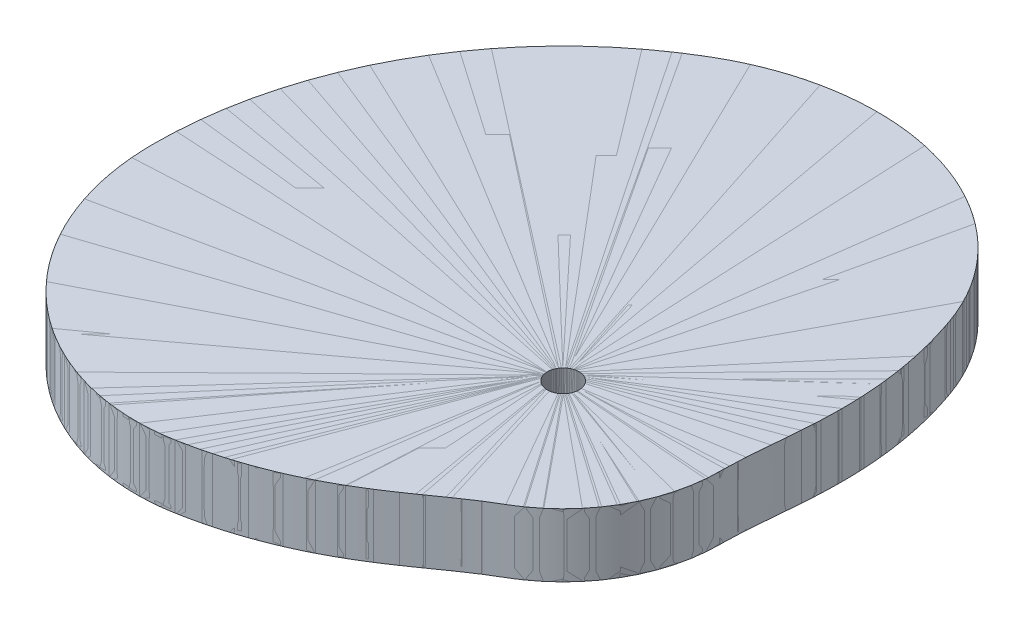
from build123d import *

# Parameters (mm, degrees)
SKETCH_1_W           = 125
SKETCH_1_H           = 20
EXTRUDE_1_DEPTH      = 10
EXTRUDE_1_DEPTH_BACK = 30
SKETCH_2_OUTSIDE_W   = 335.648
SKETCH_2_OUTSIDE_H   = 335.648
SKETCH_3_R           = 5
EXTRUDE_1_2_DEPTH    = 20


with BuildPart() as part:
    # 草图1 → 旋转1 (revolve)
    with BuildSketch(Plane.XY, mode=Mode.PRIVATE) as revolve_1_sk:
        with Locations((67.5, -10)):
            Rectangle(SKETCH_1_W, SKETCH_1_H)
    revolve(revolve_1_sk.sketch.rotate(Axis((0, -20200, 0), (0, 1, 0)), 90), axis=Axis((0, -20200, 0), (0, 1, 0)))

    # 草图2 outside → 凸台-拉伸1 (cut, two sides: drawn at the far end of the back side and taken through both)
    with BuildSketch(Plane(origin=(0, 0, 0), x_dir=(1, 0, 0), z_dir=(0, 1, 0)).offset(-EXTRUDE_1_DEPTH_BACK)):
        Rectangle(SKETCH_2_OUTSIDE_W, SKETCH_2_OUTSIDE_H)
        with BuildLine():
            ThreePointArc((49.5, 0), (49.522003902, 2.20101192), (49.586803675, 4.401179784))
            ThreePointArc((49.586803675, 4.401179784), (49.693801394, 6.656485153), (49.835800937, 8.909857504))
            ThreePointArc((49.835800937, 8.909857504), (50.014037902, 11.271336692), (50.212970941, 13.631162536))
            ThreePointArc((50.212970941, 13.631162536), (50.437148394, 16.148106857), (50.662964755, 18.664904667))
            ThreePointArc((50.662964755, 18.664904667), (50.89700113, 21.382651085), (51.110506521, 24.102087435))
            ThreePointArc((51.110506521, 24.102087435), (51.308533323, 27.06039267), (51.461958782, 30.021346081))
            ThreePointArc((51.461958782, 30.021346081), (51.569409755, 33.252730797), (51.607134457, 36.485681421))
            ThreePointArc((51.607134457, 36.485681421), (51.561933984, 40.013907512), (51.421470488, 43.539626224))
            ThreePointArc((51.421470488, 43.539626224), (51.155351471, 47.378376096), (50.768592452, 51.206853257))
            ThreePointArc((50.768592452, 51.206853257), (50.20855641, 55.358631163), (49.503236252, 59.488210272))
            ThreePointArc((49.503236252, 59.488210272), (48.573148745, 63.943471291), (47.474467997, 68.360179809))
            ThreePointArc((47.474467997, 68.360179809), (46.097521131, 73.094288239), (44.530735895, 77.769002062))
            ThreePointArc((44.530735895, 77.769002062), (42.604656504, 82.528401877), (40.298011434, 87.115455065))
            ThreePointArc((40.298011434, 87.115455065), (37.604302474, 91.545785765), (34.56817551, 95.748859775))
            ThreePointArc((34.56817551, 95.748859775), (31.174075456, 99.747159917), (27.481393941, 103.471461518))
            ThreePointArc((27.481393941, 103.471461518), (23.468076718, 106.944213921), (19.20439127, 110.104547889))
            ThreePointArc((19.20439127, 110.104547889), (14.664218285, 112.971648738), (9.924973663, 115.496128571))
            ThreePointArc((9.924973663, 115.496128571), (4.959489449, 117.692098926), (-0.151789418, 119.523259115))
            ThreePointArc((-0.151789418, 119.523259115), (-5.433965213, 120.998174308), (-10.807627759, 122.093850722))
            ThreePointArc((-10.807627759, 122.093850722), (-16.292977452, 122.813988134), (-21.815307765, 123.147944812))
            ThreePointArc((-21.815307765, 123.147944812), (-27.387630158, 123.096151544), (-32.942976067, 122.65844021))
            ThreePointArc((-32.942976067, 122.65844021), (-38.485608119, 121.834223171), (-43.958541912, 120.631268688))
            ThreePointArc((-43.958541912, 120.631268688), (-49.356557792, 119.050611025), (-54.634032237, 117.105021764))
            ThreePointArc((-54.634032237, 117.105021764), (-59.776394568, 114.79992941), (-64.75, 112.15028979))
            ThreePointArc((-64.75, 112.15028979), (-112.15028979, 64.75), (-129.5, 0))
            ThreePointArc((-129.5, 0), (-129.307852505, -5.632088462), (-128.732939877, -11.238051053))
            ThreePointArc((-128.732939877, -11.238051053), (-127.77913238, -16.781272621), (-126.449014131, -22.246420335))
            ThreePointArc((-126.449014131, -22.246420335), (-124.754336377, -27.587597274), (-122.696813244, -32.799765954))
            ThreePointArc((-122.696813244, -32.799765954), (-120.298209424, -37.829692306), (-117.556902514, -42.68136169))
            ThreePointArc((-117.556902514, -42.68136169), (-114.50652239, -47.29686169), (-111.140190251, -51.687245167))
            ThreePointArc((-111.140190251, -51.687245167), (-107.504475369, -55.793135236), (-103.586073445, -59.630176065))
            ThreePointArc((-103.586073445, -59.630176065), (-99.444602771, -63.141093315), (-95.06009455, -66.34334361))
            ThreePointArc((-95.06009455, -66.34334361), (-90.504208572, -69.185409931), (-85.751139909, -71.683764649))
            ThreePointArc((-85.751139909, -71.683764649), (-80.882367685, -73.796057576), (-75.868217271, -75.535316044))
            ThreePointArc((-75.868217271, -75.535316044), (-70.796536715, -76.871121243), (-65.636857194, -77.811348042))
            ThreePointArc((-65.636857194, -77.811348042), (-60.478824845, -78.339174116), (-55.295191431, -78.456829156))
            ThreePointArc((-55.295191431, -78.456829156), (-50.169364307, -78.160915791), (-45.084563465, -77.449249565))
            ThreePointArc((-45.084563465, -77.449249565), (-40.252749921, -76.46876847), (-35.464418323, -75.29418522))
            ThreePointArc((-35.464418323, -75.29418522), (-31.090096172, -74.0373164), (-26.766683195, -72.615165299))
            ThreePointArc((-26.766683195, -72.615165299), (-22.837702701, -71.161200919), (-18.962139542, -69.570317407))
            ThreePointArc((-18.962139542, -69.570317407), (-15.453201553, -67.991021962), (-11.995687137, -66.302112854))
            ThreePointArc((-11.995687137, -66.302112854), (-8.872093418, -64.660898454), (-5.793959756, -62.935930167))
            ThreePointArc((-5.793959756, -62.935930167), (-3.013004738, -61.286784304), (-0.268268971, -59.578036674))
            ThreePointArc((-0.268268971, -59.578036674), (2.219279173, -57.964689623), (4.682233258, -56.314040765))
            ThreePointArc((4.682233258, -56.314040765), (6.930581526, -54.769421498), (9.167200776, -53.207866842))
            ThreePointArc((9.167200776, -53.207866842), (11.233903436, -51.753905232), (13.301552432, -50.301289702))
            ThreePointArc((13.301552432, -50.301289702), (15.245755041, -48.949095714), (17.201737526, -47.613998381))
            ThreePointArc((17.201737526, -47.613998381), (19.082215454, -46.364336995), (20.981868338, -45.144021567))
            ThreePointArc((20.981868338, -45.144021567), (22.854869714, -43.987819385), (24.75, -42.868257487))
            ThreePointArc((24.75, -42.868257487), (42.868257487, -24.75), (49.5, 0))
        make_face(mode=Mode.SUBTRACT)
    extrude(amount=EXTRUDE_1_DEPTH + EXTRUDE_1_DEPTH_BACK, mode=Mode.SUBTRACT)


with BuildPart() as body_2:
    # 草图3 → Extrude 1 2 (new body)
    with BuildSketch(Plane(origin=(0, 0, 0), x_dir=(1, 0, 0), z_dir=(0, 1, 0))):
        with BuildLine():
            add(Edge.make_bspline(
                [(20.02967354, -45.750492484), (19.396443191, -46.157272465), (18.766389748, -46.568955942), (18.13955118, -46.985518105), (18.035079397, -47.054944261), (17.826315483, -47.194066912), (17.513570884, -47.40335867), (17.305649352, -47.543736891), (17.201737526, -47.613998381), (17.092747481, -47.687693583), (16.874875072, -47.835243239), (16.548389417, -48.057045545), (16.330949129, -48.205231269), (16.222283174, -48.279403522), (15.570284837, -48.724438817), (14.920243579, -49.172327875), (14.272171891, -49.623062092), (14.164160374, -49.698184161), (13.948247107, -49.848586124), (13.62459849, -50.074508861), (13.409231879, -50.225692444), (13.301552419, -50.301289712), (13.186656761, -50.38195317), (12.9568742, -50.543292558), (12.612226621, -50.785339047), (12.382479085, -50.946728306), (12.267609697, -51.027429169), (11.57839334, -51.511634363), (10.88933467, -51.996063929), (10.200433759, -52.480717816), (9.961671734, -52.648691093), (9.484185591, -52.984691533), (8.768046515, -53.488824211), (8.289727415, -53.823638559), (8.050365266, -53.99075555), (7.304821973, -54.511276242), (6.557318505, -55.028978047), (5.80786552, -55.543853584), (5.68295706, -55.629665918), (5.433032131, -55.801133368), (5.057820634, -56.057862938), (4.807464855, -56.228700698), (4.682233257, -56.314040766), (4.546114879, -56.406799717), (4.27375122, -56.592131397), (3.864130501, -56.868550928), (3.590697316, -57.052301325), (3.453865562, -57.14400469), (2.63286533, -57.694231389), (1.807742589, -58.238256445), (0.978544182, -58.776048973), (0.840346082, -58.86568), (0.563724765, -59.044594958), (0.148117104, -59.3119263), (-0.129399447, -59.489449478), (-0.268268971, -59.578036674), (-0.41970353, -59.674639318), (-0.72283723, -59.86742985), (-1.178907914, -60.154468013), (-1.483541683, -60.344879857), (-1.636029221, -60.439811661), (-2.550976623, -61.009416293), (-3.472014376, -61.569119467), (-4.39903533, -62.118856072), (-4.553535078, -62.210476619), (-4.862863975, -62.393162244), (-5.327846296, -62.665524676), (-5.638480806, -62.845981333), (-5.793959756, -62.935930167), (-5.963642857, -63.034096491), (-6.303394236, -63.229763347), (-6.814600367, -63.520535283), (-7.156191635, -63.712972575), (-7.327202959, -63.808806331), (-8.353309886, -64.383830713), (-9.387088209, -64.944946428), (-10.428349409, -65.492051151), (-10.601886349, -65.583231807), (-10.949370664, -65.764811972), (-11.471829806, -66.034839379), (-11.820934744, -66.213283902), (-11.995687137, -66.302112854), (-12.18626196, -66.398984556), (-12.567887137, -66.591792449), (-13.14202307, -66.877666185), (-13.525711142, -67.066335946), (-13.71780122, -67.160167133), (-14.870401126, -67.72318329), (-16.031716064, -68.267996424), (-17.201458575, -68.794471678), (-17.396405607, -68.882213029), (-17.786759816, -69.05667336), (-18.373673649, -69.315297494), (-18.765836243, -69.48565393), (-18.962139542, -69.570317407), (-19.175861758, -69.662493472), (-19.603832486, -69.845625312), (-20.247509004, -70.116339159), (-20.67762689, -70.294369789), (-20.892944236, -70.382755606), (-22.184931139, -70.913104507), (-23.486022019, -71.420709308), (-24.795816527, -71.905413816), (-25.014101617, -71.986192722), (-25.451144125, -72.146474185), (-26.108103512, -72.383136958), (-26.547007167, -72.538249405), (-26.766683196, -72.6151653), (-27.005339101, -72.698726681), (-27.483180144, -72.86433793), (-28.201533111, -73.108221176), (-28.681433591, -73.267766393), (-28.921634041, -73.346778353), (-30.362945144, -73.820885773), (-31.813003875, -74.267523452), (-33.271286745, -74.686530148), (-33.51431561, -74.756359344), (-34.000815598, -74.894478528), (-34.731874933, -75.09711935), (-35.220102317, -75.229002134), (-35.464418323, -75.29418522), (-35.729079727, -75.364796424), (-36.258877362, -75.504239109), (-37.055002901, -75.708064721), (-37.586627985, -75.840369547), (-37.852659941, -75.905627492), (-39.448987027, -76.297208363), (-41.052888459, -76.656507598), (-42.663711494, -76.983378972), (-42.932159237, -77.037852915), (-43.469421033, -77.14499562), (-44.276417304, -77.300294596), (-44.815071471, -77.400201977), (-45.084563465, -77.449249565), (-45.3652539, -77.500335272), (-45.926992572, -77.600540744), (-46.772616664, -77.734353434), (-47.337175116, -77.817276339), (-47.619722541, -77.856821538), (-49.315592201, -78.094174622), (-51.019714252, -78.262336522), (-52.729266892, -78.361028784), (-53.014094026, -78.377471819), (-53.58397133, -78.406494459), (-54.439473508, -78.438591884), (-55.009931036, -78.451994186), (-55.295191431, -78.456829156), (-55.583260451, -78.461711731), (-56.159463004, -78.467670662), (-57.023979274, -78.465186982), (-57.600138077, -78.455917417), (-57.888174288, -78.449379742), (-59.616957525, -78.410140844), (-61.342827543, -78.302419658), (-63.063072621, -78.126385437), (-63.34443353, -78.097593523), (-63.906781897, -78.036360241), (-64.749221659, -77.933699361), (-65.30977265, -77.857759724), (-65.589799881, -77.818039633), (-65.883563239, -77.776371158), (-66.470543519, -77.689181815), (-67.349393021, -77.546834209), (-67.933884612, -77.444279782), (-68.225781634, -77.39108861), (-69.94653127, -77.077523607), (-71.653881798, -76.697712477), (-73.345283839, -76.252222345), (-73.617145111, -76.180618131), (-74.15997792, -76.034031631), (-74.971614448, -75.804147739), (-75.51059716, -75.64398578), (-75.779598843, -75.562292396), (-76.071619007, -75.473608506), (-76.654505212, -75.29244041), (-77.525389581, -75.009278067), (-78.103362969, -74.813000276), (-78.39169887, -74.712985196), (-80.063875617, -74.13295721), (-81.712984665, -73.490269971), (-83.336679016, -72.785838149), (-83.593650873, -72.67435217), (-84.106262931, -72.448310786), (-84.871257719, -72.100155902), (-85.378268365, -71.861817267), (-85.63107713, -71.741188138), (-85.913702996, -71.606331611), (-86.477213616, -71.33296962), (-87.317272228, -70.911967977), (-87.873536365, -70.624146492), (-88.150727877, -70.478446362), (-89.735803666, -69.645283229), (-91.289058431, -68.754202034), (-92.808376806, -67.806416333), (-93.045212546, -67.658672759), (-93.517183702, -67.360459958), (-94.220120919, -66.905060112), (-94.685037697, -66.595965594), (-94.916626461, -66.44012601), (-95.182867737, -66.260968228), (-95.713051613, -65.899236668), (-96.501445694, -65.346377129), (-97.022172726, -64.971159828), (-97.281322025, -64.781888677), (-98.74346293, -63.714005825), (-100.166011218, -62.59392271), (-101.547104234, -61.423105946), (-101.758835264, -61.243611708), (-102.180305307, -60.88227345), (-102.806619608, -60.333291799), (-103.21989597, -59.962610695), (-103.425527214, -59.776159623), (-103.669131163, -59.555277736), (-104.153512732, -59.11039689), (-104.87161844, -58.433707985), (-105.344456405, -57.976577008), (-105.579403449, -57.746508369), (-106.886088596, -56.466955031), (-108.146436795, -55.141736092), (-109.358853165, -53.772528524), (-109.540904118, -53.566934514), (-109.9028091, -53.153801145), (-110.439159046, -52.528318934), (-110.792083771, -52.107488628), (-110.967442779, -51.896157928), (-111.182972851, -51.636415804), (-111.610699464, -51.114165441), (-112.242298994, -50.322472963), (-112.656479689, -49.789415886), (-112.861851265, -49.521569477), (-113.98442211, -48.057508213), (-115.054970903, -46.554988341), (-116.072181222, -45.015857466), (-116.220463011, -44.791493758), (-116.514732208, -44.341249986), (-116.949328664, -43.661369775), (-117.234265817, -43.205163293), (-117.375586175, -42.976350882), (-117.558505556, -42.680185311), (-117.920496942, -42.085477932), (-118.451949803, -41.186267173), (-118.798367915, -40.582355655), (-118.969608449, -40.279287635), (-119.883743587, -38.66141645), (-120.741253882, -37.012833328), (-121.54110888, -35.335519343), (-121.652068468, -35.102834582), (-121.871749153, -34.636397598), (-122.194618269, -33.933558122), (-122.405232605, -33.46295798), (-122.509421559, -33.227163811), (-122.656214719, -32.894950367), (-122.945361649, -32.228561873), (-123.365769234, -31.223070119), (-123.637003096, -30.549191967), (-123.770362804, -30.211361843), (-124.456473965, -28.473288017), (-125.082456746, -26.712664631), (-125.647571812, -24.931571115), (-125.718102316, -24.709277584), (-125.857255919, -24.264085331), (-126.060310956, -23.594488287), (-126.191767571, -23.146962924), (-126.256543805, -22.922924969), (-126.365052257, -22.547632829), (-126.576726028, -21.795503687), (-126.878209428, -20.66264513), (-127.068381121, -19.90479372), (-127.160764853, -19.525210369), (-127.604310219, -17.702785221), (-127.985335138, -15.866270608), (-128.303394751, -14.01781071), (-128.347923311, -13.75902508), (-128.434503926, -13.241027694), (-128.556971068, -12.462747808), (-128.633600133, -11.943185096), (-128.670677671, -11.683227309), (-128.721941532, -11.323806476), (-128.819739937, -10.604290273), (-128.952248312, -9.522968386), (-129.031078033, -8.801127705), (-129.068116767, -8.439963683), (-129.259828378, -6.570587247), (-129.387795304, -4.695768305), (-129.451869224, -2.81767988), (-129.462545632, -2.504740734), (-129.480347116, -1.878741283), (-129.49772869, -0.939363643), (-129.5, -0.313121214), (-129.5, 0), (-129.5, 0.314010981), (-129.497715763, 0.942032944), (-129.487436017, 1.884072118), (-129.476015104, 2.511994379), (-129.469162801, 2.825930587), (-128.481878812, 48.058050592), (-105.860432075, 87.239545681), (-67.181909078, 110.710618699), (-66.913458499, 110.873521071), (-66.375372325, 111.197373002), (-65.564682343, 111.67729511), (-65.021941488, 111.993284299), (-64.750000001, 112.15028979), (-64.478829074, 112.306850397), (-63.935351567, 112.618004599), (-63.11313588, 113.072640535), (-62.56210371, 113.370223723), (-62.285752256, 113.517447256), (-60.627243009, 114.401001826), (-58.939618715, 115.227588688), (-57.224835427, 115.996249781), (-56.893538843, 116.144755307), (-56.228991614, 116.437407106), (-55.226285203, 116.863312431), (-54.55426669, 117.138374629), (-54.217367188, 117.27368924), (-53.973698371, 117.371558043), (-53.485429331, 117.564976683), (-52.750185608, 117.848056969), (-52.258296405, 118.032074651), (-52.011917195, 118.122904602), (-50.252074159, 118.771686845), (-48.47109339, 119.359966893), (-46.671054232, 119.887057912), (-46.296133542, 119.996842928), (-45.544729122, 120.211075116), (-44.412903133, 120.516412111), (-43.655703304, 120.70916182), (-43.276436551, 120.802836814), (-43.050025874, 120.858757927), (-42.596729233, 120.96867584), (-41.915313664, 121.127623542), (-41.460189061, 121.229709113), (-41.232411964, 121.27977467), (-39.4073822, 121.680917425), (-37.569646231, 122.019112128), (-35.721374563, 122.293959346), (-35.36212524, 122.347381512), (-34.642912709, 122.449425174), (-33.561927515, 122.588087402), (-32.840244685, 122.670873062), (-32.479142823, 122.709853178), (-32.222844605, 122.737519982), (-31.70998576, 122.790422688), (-30.939874361, 122.862229569), (-30.426087741, 122.905199007), (-30.169097033, 122.925447566), (-28.316573013, 123.071409811), (-26.460103001, 123.153075672), (-24.601917886, 123.170347013), (-24.253833015, 123.17358237), (-23.557621242, 123.175531244), (-22.513155451, 123.164884945), (-21.81712806, 123.148744898), (-21.469181461, 123.138414853), (-21.200363922, 123.130434038), (-20.662808942, 123.111774466), (-19.85671718, 123.075343001), (-19.319660038, 123.045620286), (-19.051214472, 123.029386344), (-17.209682875, 122.918021804), (-15.3731881, 122.742159289), (-13.543988431, 122.502015052), (-13.209340848, 122.458081255), (-12.54060953, 122.365918789), (-11.539183966, 122.21478379), (-10.873038579, 122.10548686), (-10.540330265, 122.048703403), (-10.269633006, 122.002503398), (-9.728720908, 121.907276774), (-8.91886245, 121.755525201), (-8.380125967, 121.648672977), (-8.111050855, 121.593809231), (-6.319074133, 121.22842964), (-4.541226767, 120.799545551), (-2.779758497, 120.307699687), (-2.463039689, 120.219263899), (-1.830733668, 120.038339697), (-0.885651032, 119.754786364), (-0.258182133, 119.557740044), (0.054909167, 119.457213779), (0.319196154, 119.372357434), (0.846853588, 119.199790157), (1.635442794, 118.931876888), (2.159105926, 118.747542252), (2.420418012, 118.653924921), (4.124921581, 118.043271666), (5.806216156, 117.371350268), (7.462100287, 116.639040526), (7.755588562, 116.509246225), (8.340899792, 116.245892037), (9.213887237, 115.839552505), (9.792247896, 115.561265579), (10.080523725, 115.420272762), (10.331279145, 115.297630801), (10.831421239, 115.04954832), (11.577277683, 114.668486755), (12.071523122, 114.408854145), (12.317890681, 114.277620165), (13.898356363, 113.435744706), (15.446682697, 112.536127219), (16.96076103, 111.579992885), (17.2255368, 111.412788058), (17.752929586, 111.074959927), (18.53755701, 110.55794865), (19.056050749, 110.206615133), (19.31415286, 110.029282217), (19.545025133, 109.870657969), (20.004937768, 109.550743187), (20.688946136, 109.062315708), (21.141009746, 108.731401336), (21.366045364, 108.564600169), (22.787948394, 107.510655525), (24.169086393, 106.403828815), (25.507493737, 105.245695265), (25.738277288, 105.04599659), (26.197245535, 104.643595849), (26.877913502, 104.030969033), (27.326252779, 103.61675882), (27.549065362, 103.408203884), (27.75431475, 103.216088285), (28.16251043, 102.829396544), (28.767413985, 102.241440638), (29.165778022, 101.844626886), (29.363719727, 101.644990225), (30.595226518, 100.402938156), (31.77782787, 99.11423479), (32.909757946, 97.780804393), (33.101771363, 97.554609743), (33.482831897, 97.09970239), (34.045533291, 96.409770199), (34.414531616, 95.945025038), (34.597499253, 95.711452744), (34.771911477, 95.488802094), (35.117952627, 95.041320513), (35.628079439, 94.363076718), (35.9622832, 93.906685387), (36.127898184, 93.677415649), (37.14047083, 92.275656821), (38.096695123, 90.834870135), (38.995068624, 89.357319383), (39.144748522, 89.111141545), (39.440855602, 88.616808167), (39.875264667, 87.869356955), (40.158205358, 87.367371441), (40.298011434, 87.115455064), (40.436454424, 86.865994831), (40.710076454, 86.365262968), (41.110030358, 85.608327637), (41.369834667, 85.100288095), (41.498008148, 84.845399043), (42.267314461, 83.315536897), (42.973743009, 81.75564296), (43.616124039, 80.168300211), (43.723150605, 79.903834364), (43.933616489, 79.373450949), (44.240543346, 78.574212659), (44.434632197, 78.037629963), (44.530735895, 77.769002062), (44.623005434, 77.511091355), (44.805810188, 76.994649471), (45.074815465, 76.218120712), (45.250658059, 75.699266996), (45.337706112, 75.43954746), (45.860038715, 73.881098103), (46.350827167, 72.3124291), (46.809871728, 70.734178855), (46.886372668, 70.471159451), (47.037605869, 69.94460621), (47.259150481, 69.153228463), (47.40328839, 68.62468891), (47.474467997, 68.360179809), (47.540175791, 68.116004397), (47.670075641, 67.627245688), (47.860113209, 66.892809321), (47.983748482, 66.402428381), (48.044789056, 66.157044612), (48.411060048, 64.684631252), (48.749289838, 63.205524715), (49.059356319, 61.720258975), (49.111030179, 61.472733304), (49.212810209, 60.977354688), (49.360777606, 60.233301146), (49.456274578, 59.73667304), (49.503236252, 59.488210272), (49.546463147, 59.259507304), (49.631583656, 58.801849365), (49.755107375, 58.11457446), (49.834820811, 57.655943814), (49.874006771, 57.426513928), (50.109137607, 56.049846356), (50.320084395, 54.669266201), (50.506782225, 53.285198271), (50.537896535, 53.054535071), (50.59877643, 52.59302674), (50.686169621, 51.9002296), (50.741558159, 51.438030157), (50.768592452, 51.206853257), (50.793423381, 50.994517875), (50.841971677, 50.569716888), (50.911453523, 49.932122531), (50.955543549, 49.506835704), (50.977030826, 49.294135948), (51.105961137, 48.01787159), (51.214796591, 46.739736785), (51.30351025, 45.460047907), (51.318295097, 45.246777427), (51.346746327, 44.820158929), (51.386240376, 44.180005757), (51.410076432, 43.753104712), (51.421470488, 43.539626224), (51.431918555, 43.343871736), (51.451933534, 42.952315729), (51.479312511, 42.364839137), (51.495801633, 41.97311881), (51.503605338, 41.777241083), (51.55042935, 40.60193007), (51.581378047, 39.426093923), (51.596445788, 38.249947067), (51.598956983, 38.053930038), (51.603097034, 37.661884676), (51.606884216, 37.073781212), (51.607307437, 36.681714458), (51.607134457, 36.485681421), (51.606975957, 36.306058283), (51.606013163, 35.946812578), (51.602631538, 35.407944859), (51.599085595, 35.048715364), (51.596989748, 34.869104384), (51.584414359, 33.791412385), (51.560216068, 32.713918707), (51.524397688, 31.636748698), (51.518428102, 31.457224714), (51.505843493, 31.098198209), (51.485296494, 30.559710329), (51.469901846, 30.200793579), (51.461958782, 30.021346081), (51.454674781, 29.856787948), (51.439693475, 29.527689975), (51.415981572, 29.034097511), (51.399347333, 28.705078945), (51.390823635, 28.540580366), (51.339680848, 27.553577217), (51.2811027, 26.566987434), (51.215092517, 25.580867027), (51.204090949, 25.41651557), (51.181675031, 25.087840287), (51.147099053, 24.594888572), (51.12277894, 24.266348884), (51.110506521, 24.102087435), (51.099215654, 23.950963657), (51.076443703, 23.648730312), (51.041715123, 23.195422839), (51.018182419, 22.893247776), (51.006320987, 22.74216771), (50.935152186, 21.835684618), (50.860561005, 20.929476723), (50.782548509, 20.023556944), (50.757502024, 19.732704747), (50.706703843, 19.151061082), (50.628181675, 18.278800111), (50.57593983, 17.697284761), (50.549851717, 17.406524143), (50.474579594, 16.56759151), (50.399580619, 15.728634414), (50.324854798, 14.889652943), (50.312400496, 14.749822703), (50.287507065, 14.470160871), (50.250212446, 14.050664068), (50.225379718, 13.770996839), (50.212970943, 13.631162552), (50.201341519, 13.500110769), (50.178096001, 13.238006022), (50.144265479, 12.844756729), (50.121970193, 12.582569373), (50.110918331, 12.451467621), (50.044606893, 11.664853968), (49.981744219, 10.877957195), (49.922331516, 10.090792424), (49.912429439, 9.959598821), (49.892816981, 9.697197146), (49.863973377, 9.303551122), (49.845127831, 9.041093253), (49.835800937, 8.909857504), (49.826908615, 8.784736478), (49.809298275, 8.534482039), (49.784418595, 8.158991391), (49.768316802, 7.908635214), (49.760427879, 7.783446918), (49.713093747, 7.032307712), (49.67159212, 6.280823686), (49.635925497, 5.529040127), (49.629981134, 5.403744441), (49.618416634, 5.153137685), (49.602042556, 4.777181091), (49.59177519, 4.526517841), (49.586803675, 4.401179784), (49.58195703, 4.278989872), (49.572571986, 4.03459782), (49.560251719, 3.667940682), (49.552655486, 3.423486365), (49.549055457, 3.301253372), (49.527454851, 2.567840971), (49.512986432, 1.834253211), (49.505651567, 1.100559449), (49.503203199, 0.855653421), (49.499896253, 0.365825472), (49.500442653, -0.368978597), (49.493156006, -0.85877442), (49.487695408, -1.103631805), (49.102520818, -18.375155434), (40.464611813, -33.336452702), (25.699620884, -42.305785496), (25.490298467, -42.432943205), (25.069766165, -42.684151538), (24.433133974, -43.051080376), (24.010584, -43.29885825), (23.799713343, -43.423431613), (23.167983339, -43.796630673), (22.539911912, -44.175954571), (21.915558444, -44.561367445), (21.811501582, -44.625601659), (21.60359605, -44.754407347), (21.292221787, -44.948405581), (21.085264583, -45.078729293), (20.981868338, -45.144021567), (20.875808154, -45.210996054), (20.663861095, -45.345219479), (20.346460172, -45.547378143), (20.135210606, -45.682696672), (20.02967354, -45.750492484)],
                knots=[0, 0, 0, 0, 0.003776693, 0.003776693, 0.003776693, 0.004406147, 0.0050356, 0.005665054, 0.005665054, 0.005665054, 0.006325269, 0.006985485, 0.0076457, 0.0076457, 0.0076457, 0.011606982, 0.011606982, 0.011606982, 0.012267198, 0.012927413, 0.013587628, 0.013587628, 0.013587628, 0.014292088, 0.014996548, 0.015701008, 0.015701008, 0.015701008, 0.019927768, 0.019927768, 0.019927768, 0.021392695, 0.022857623, 0.02432255, 0.02432255, 0.02432255, 0.02888535, 0.02888535, 0.02888535, 0.029645818, 0.030406286, 0.031166754, 0.031166754, 0.031166754, 0.031993332, 0.03281991, 0.033646488, 0.033646488, 0.033646488, 0.03860592, 0.03860592, 0.03860592, 0.039432498, 0.040259076, 0.041085654, 0.041085654, 0.041085654, 0.041987021, 0.042888389, 0.043789756, 0.043789756, 0.043789756, 0.049197882, 0.049197882, 0.049197882, 0.050099249, 0.051000617, 0.051901984, 0.051901984, 0.051901984, 0.052885698, 0.053869412, 0.054853126, 0.054853126, 0.054853126, 0.060755275, 0.060755275, 0.060755275, 0.061738989, 0.062722703, 0.063706417, 0.063706417, 0.063706417, 0.064779199, 0.06585198, 0.066924761, 0.066924761, 0.066924761, 0.073361251, 0.073361251, 0.073361251, 0.074434032, 0.075506813, 0.076579595, 0.076579595, 0.076579595, 0.077747569, 0.078915543, 0.080083518, 0.080083518, 0.080083518, 0.087091094, 0.087091094, 0.087091094, 0.088259069, 0.089427043, 0.090595017, 0.090595017, 0.090595017, 0.091863904, 0.09313279, 0.094401677, 0.094401677, 0.094401677, 0.102014653, 0.102014653, 0.102014653, 0.10328354, 0.104552426, 0.105821313, 0.105821313, 0.105821313, 0.107195866, 0.108570419, 0.109944972, 0.109944972, 0.109944972, 0.118191871, 0.118191871, 0.118191871, 0.119566424, 0.120940977, 0.12231553, 0.12231553, 0.12231553, 0.123747201, 0.125178872, 0.126610543, 0.126610543, 0.126610543, 0.135198792, 0.135198792, 0.135198792, 0.136630463, 0.138062134, 0.139493805, 0.139493805, 0.139493805, 0.140939572, 0.142385339, 0.143831106, 0.143831106, 0.143831106, 0.152504005, 0.152504005, 0.152504005, 0.153923275, 0.155342546, 0.156761817, 0.156761817, 0.156761817, 0.158250707, 0.159739596, 0.161228486, 0.161228486, 0.161228486, 0.170001209, 0.170001209, 0.170001209, 0.171411962, 0.172822715, 0.174233469, 0.174233469, 0.174233469, 0.17576494, 0.177296412, 0.178827883, 0.178827883, 0.178827883, 0.187705294, 0.187705294, 0.187705294, 0.189110933, 0.190516572, 0.19192221, 0.19192221, 0.19192221, 0.193493634, 0.195065059, 0.196636483, 0.196636483, 0.196636483, 0.205618345, 0.205618345, 0.205618345, 0.207019099, 0.208419854, 0.209820608, 0.209820608, 0.209820608, 0.211430957, 0.213041305, 0.214651654, 0.214651654, 0.214651654, 0.223733403, 0.223733403, 0.223733403, 0.225126306, 0.226519208, 0.22791211, 0.22791211, 0.22791211, 0.229562232, 0.231212353, 0.232862475, 0.232862475, 0.232862475, 0.242035944, 0.242035944, 0.242035944, 0.243413972, 0.244792, 0.246170028, 0.246170028, 0.246170028, 0.247863734, 0.249557439, 0.251251144, 0.251251144, 0.251251144, 0.260505223, 0.260505223, 0.260505223, 0.261854771, 0.263204319, 0.264553867, 0.264553867, 0.264553867, 0.266300668, 0.268047468, 0.269794269, 0.269794269, 0.269794269, 0.279115497, 0.279115497, 0.279115497, 0.280409099, 0.281702701, 0.282996303, 0.282996303, 0.282996303, 0.284818876, 0.286641448, 0.288464021, 0.288464021, 0.288464021, 0.29783713, 0.29783713, 0.29783713, 0.299007424, 0.300177718, 0.301348011, 0.301348011, 0.301348011, 0.303308402, 0.305268793, 0.307229184, 0.307229184, 0.307229184, 0.316637592, 0.316637592, 0.316637592, 0.317955288, 0.319272985, 0.320590681, 0.320590681, 0.320590681, 0.322412544, 0.324234407, 0.326056271, 0.326056271, 0.326056271, 0.335482548, 0.335482548, 0.335482548, 0.337053822, 0.338625096, 0.34019637, 0.34019637, 0.34019637, 0.341772108, 0.343347847, 0.344923586, 0.344923586, 0.344923586, 0.553299408, 0.553299408, 0.553299408, 0.554875147, 0.556450886, 0.558026624, 0.558026624, 0.558026624, 0.559597898, 0.561169172, 0.562740446, 0.562740446, 0.562740446, 0.572166723, 0.572166723, 0.572166723, 0.573988587, 0.57581045, 0.577632313, 0.577632313, 0.577632313, 0.578950009, 0.580267706, 0.581585402, 0.581585402, 0.581585402, 0.59099381, 0.59099381, 0.59099381, 0.592954201, 0.594914592, 0.596874983, 0.596874983, 0.596874983, 0.598045277, 0.59921557, 0.600385864, 0.600385864, 0.600385864, 0.609758973, 0.609758973, 0.609758973, 0.611581546, 0.613404118, 0.615226691, 0.615226691, 0.615226691, 0.616520293, 0.617813895, 0.619107497, 0.619107497, 0.619107497, 0.628428726, 0.628428726, 0.628428726, 0.630175526, 0.631922327, 0.633669127, 0.633669127, 0.633669127, 0.635018675, 0.636368223, 0.637717771, 0.637717771, 0.637717771, 0.64697185, 0.64697185, 0.64697185, 0.648665555, 0.65035926, 0.652052966, 0.652052966, 0.652052966, 0.653430994, 0.654809022, 0.65618705, 0.65618705, 0.65618705, 0.66536052, 0.66536052, 0.66536052, 0.667010641, 0.668660762, 0.670310884, 0.670310884, 0.670310884, 0.671703786, 0.673096689, 0.674489591, 0.674489591, 0.674489591, 0.68357134, 0.68357134, 0.68357134, 0.685181689, 0.686792037, 0.688402386, 0.688402386, 0.688402386, 0.689803141, 0.691203895, 0.692604649, 0.692604649, 0.692604649, 0.701586511, 0.701586511, 0.701586511, 0.703157935, 0.70472936, 0.706300784, 0.706300784, 0.706300784, 0.707706423, 0.709112061, 0.7105177, 0.7105177, 0.7105177, 0.719395111, 0.719395111, 0.719395111, 0.720926582, 0.722458054, 0.723989525, 0.723989525, 0.723989525, 0.725400279, 0.726811032, 0.728221785, 0.728221785, 0.728221785, 0.736994508, 0.736994508, 0.736994508, 0.738483398, 0.739972288, 0.741461177, 0.741461177, 0.741461177, 0.742880448, 0.744299719, 0.745718989, 0.745718989, 0.745718989, 0.754391888, 0.754391888, 0.754391888, 0.755837655, 0.757283422, 0.758729189, 0.758729189, 0.758729189, 0.76016086, 0.761592531, 0.763024202, 0.763024202, 0.763024202, 0.771612451, 0.771612451, 0.771612451, 0.773044122, 0.774475793, 0.775907464, 0.775907464, 0.775907464, 0.777282017, 0.77865657, 0.780031123, 0.780031123, 0.780031123, 0.788278022, 0.788278022, 0.788278022, 0.789652575, 0.791027128, 0.792401681, 0.792401681, 0.792401681, 0.793670568, 0.794939454, 0.796208341, 0.796208341, 0.796208341, 0.803821317, 0.803821317, 0.803821317, 0.805090204, 0.80635909, 0.807627977, 0.807627977, 0.807627977, 0.808795951, 0.809963926, 0.8111319, 0.8111319, 0.8111319, 0.818139476, 0.818139476, 0.818139476, 0.819307451, 0.820475425, 0.821643399, 0.821643399, 0.821643399, 0.822716181, 0.823788962, 0.824861743, 0.824861743, 0.824861743, 0.831298233, 0.831298233, 0.831298233, 0.832371014, 0.833443795, 0.834516577, 0.834516577, 0.834516577, 0.835500291, 0.836484005, 0.837467719, 0.837467719, 0.837467719, 0.843369868, 0.843369868, 0.843369868, 0.844353582, 0.845337296, 0.84632101, 0.84632101, 0.84632101, 0.847222377, 0.848123745, 0.849025112, 0.849025112, 0.849025112, 0.854433238, 0.854433238, 0.854433238, 0.855334605, 0.856235973, 0.85713734, 0.85713734, 0.85713734, 0.857963918, 0.858790496, 0.859617074, 0.859617074, 0.859617074, 0.864576506, 0.864576506, 0.864576506, 0.865403084, 0.866229662, 0.86705624, 0.86705624, 0.86705624, 0.867816708, 0.868577176, 0.869337644, 0.869337644, 0.869337644, 0.873900444, 0.873900444, 0.873900444, 0.875365371, 0.876830299, 0.878295226, 0.878295226, 0.878295226, 0.882521986, 0.882521986, 0.882521986, 0.883226446, 0.883930906, 0.884635366, 0.884635366, 0.884635366, 0.885295581, 0.885955797, 0.886616012, 0.886616012, 0.886616012, 0.890577294, 0.890577294, 0.890577294, 0.891237509, 0.891897725, 0.89255794, 0.89255794, 0.89255794, 0.893187394, 0.893816847, 0.894446301, 0.894446301, 0.894446301, 0.898222994, 0.898222994, 0.898222994, 0.898852448, 0.899481901, 0.900111355, 0.900111355, 0.900111355, 0.900724998, 0.901338642, 0.901952285, 0.901952285, 0.901952285, 0.905634103, 0.905634103, 0.905634103, 0.906863127, 0.908092152, 0.909321177, 0.909321177, 0.909321177, 0.988901818, 0.988901818, 0.988901818, 0.990130842, 0.991359867, 0.992588891, 0.992588891, 0.992588891, 0.996270709, 0.996270709, 0.996270709, 0.996884352, 0.997497996, 0.998111639, 0.998111639, 0.998111639, 0.998741093, 0.999370546, 1, 1, 1, 1], degree=3, weights=[1, 0.999979912, 0.999979912, 1, 1, 1, 1, 1, 1, 1, 1, 1, 1, 1, 0.999993595, 0.999993595, 1, 1, 1, 1, 1, 1, 1, 1, 1, 1, 1, 0.999999965, 0.999999965, 1, 1, 1, 1, 1, 1, 0.999995247, 0.999995247, 1, 1, 1, 1, 1, 1, 1, 1, 1, 1, 1, 0.999981076, 0.999981076, 1, 1, 1, 1, 1, 1, 1, 1, 1, 1, 1, 0.999961222, 0.999961222, 1, 1, 1, 1, 1, 1, 1, 1, 1, 1, 1, 0.999939214, 0.999939214, 1, 1, 1, 1, 1, 1, 1, 1, 1, 1, 1, 0.99991749, 0.99991749, 1, 1, 1, 1, 1, 1, 1, 1, 1, 1, 1, 0.999897432, 0.999897432, 1, 1, 1, 1, 1, 1, 1, 1, 1, 1, 1, 0.999879662, 0.999879662, 1, 1, 1, 1, 1, 1, 1, 1, 1, 1, 1, 0.999864343, 0.999864343, 1, 1, 1, 1, 1, 1, 1, 1, 1, 1, 1, 0.999448044, 0.999448044, 1, 1, 1, 1, 1, 1, 1, 1, 1, 1, 1, 0.99947626, 0.99947626, 1, 1, 1, 1, 1, 1, 1, 1, 1, 1, 1, 0.999502274, 0.999502274, 1, 1, 1, 1, 1, 1, 1, 1, 1, 1, 1, 0.999525603, 0.999525603, 1, 1, 1, 1, 1, 1, 1, 1, 1, 1, 1, 0.999546036, 0.999546036, 1, 1, 1, 1, 1, 1, 1, 1, 1, 1, 1, 0.999563541, 0.999563541, 1, 1, 1, 1, 1, 1, 1, 1, 1, 1, 1, 0.99957819, 0.99957819, 1, 1, 1, 1, 1, 1, 1, 1, 1, 1, 1, 0.99959011, 0.99959011, 1, 1, 1, 1, 1, 1, 1, 1, 1, 1, 1, 0.999599439, 0.999599439, 1, 1, 1, 1, 1, 1, 1, 1, 1, 1, 1, 0.999606308, 0.999606308, 1, 1, 1, 1, 1, 1, 1, 1, 1, 1, 1, 0.999610824, 0.999610824, 1, 1, 1, 1, 1, 1, 1, 1, 1, 1, 1, 0.999613647, 0.999613647, 1, 1, 1, 1, 1, 1, 1, 1, 1, 1, 1, 0.917820074, 0.917820074, 1, 1, 1, 1, 1, 1, 1, 1, 1, 1, 1, 0.999613647, 0.999613647, 1, 1, 1, 1, 1, 1, 1, 1, 1, 1, 1, 0.999610824, 0.999610824, 1, 1, 1, 1, 1, 1, 1, 1, 1, 1, 1, 0.999606308, 0.999606308, 1, 1, 1, 1, 1, 1, 1, 1, 1, 1, 1, 0.999599439, 0.999599439, 1, 1, 1, 1, 1, 1, 1, 1, 1, 1, 1, 0.99959011, 0.99959011, 1, 1, 1, 1, 1, 1, 1, 1, 1, 1, 1, 0.99957819, 0.99957819, 1, 1, 1, 1, 1, 1, 1, 1, 1, 1, 1, 0.999563541, 0.999563541, 1, 1, 1, 1, 1, 1, 1, 1, 1, 1, 1, 0.999546036, 0.999546036, 1, 1, 1, 1, 1, 1, 1, 1, 1, 1, 1, 0.999525603, 0.999525603, 1, 1, 1, 1, 1, 1, 1, 1, 1, 1, 1, 0.999502274, 0.999502274, 1, 1, 1, 1, 1, 1, 1, 1, 1, 1, 1, 0.99947626, 0.99947626, 1, 1, 1, 1, 1, 1, 1, 1, 1, 1, 1, 0.999448044, 0.999448044, 1, 1, 1, 1, 1, 1, 1, 1, 1, 1, 1, 0.999864343, 0.999864343, 1, 1, 1, 1, 1, 1, 1, 1, 1, 1, 1, 0.999879662, 0.999879662, 1, 1, 1, 1, 1, 1, 1, 1, 1, 1, 1, 0.999897432, 0.999897432, 1, 1, 1, 1, 1, 1, 1, 1, 1, 1, 1, 0.99991749, 0.99991749, 1, 1, 1, 1, 1, 1, 1, 1, 1, 1, 1, 0.999939214, 0.999939214, 1, 1, 1, 1, 1, 1, 1, 1, 1, 1, 1, 0.999961222, 0.999961222, 1, 1, 1, 1, 1, 1, 1, 1, 1, 1, 1, 0.999981076, 0.999981076, 1, 1, 1, 1, 1, 1, 1, 1, 1, 1, 1, 0.999995247, 0.999995247, 1, 1, 1, 1, 1, 1, 0.999999965, 0.999999965, 1, 1, 1, 1, 1, 1, 1, 1, 1, 1, 1, 0.999993595, 0.999993595, 1, 1, 1, 1, 1, 1, 1, 1, 1, 1, 1, 0.999979912, 0.999979912, 1, 1, 1, 1, 1, 1, 1, 1, 1, 1, 1, 0.999968485, 0.999968485, 1, 1, 1, 1, 1, 1, 0.91797195, 0.91797195, 1, 1, 1, 1, 1, 1, 0.999968485, 0.999968485, 1, 1, 1, 1, 1, 1, 1, 1, 1, 1, 1]))
        make_face()
        with Locations(Location((0, 0, 0), (0, 0, 270))):
            Circle(SKETCH_3_R, mode=Mode.SUBTRACT)
    extrude(amount=-EXTRUDE_1_2_DEPTH)


solid = Compound([part.part, body_2.part])
